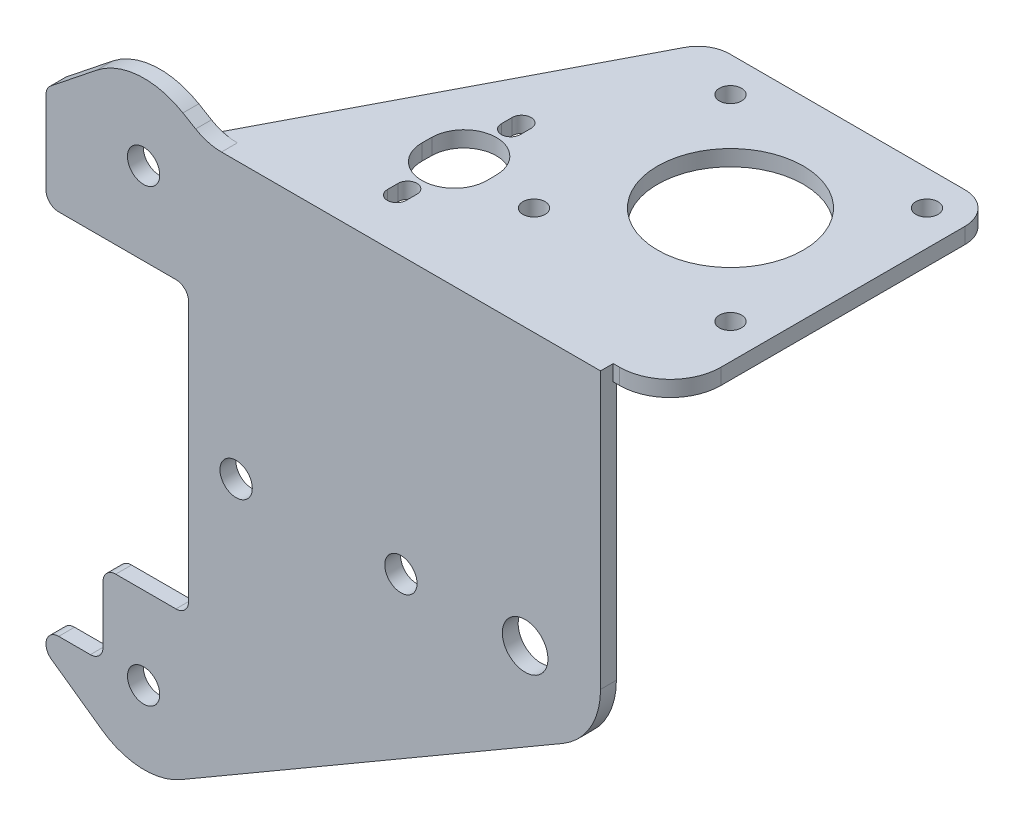
from build123d import *

# Parameters (mm, degrees)
SALIENTE_EXTRUIR1_DEPTH             = 2.5
CROQUIS2_W                          = 51
CROQUIS2_H                          = 2.5
SALIENTE_EXTRUIR2_DEPTH             = 36.177083333
SALIENTE_EXTRUIR3_DEPTH             = 2.5
CROQUIS4_W                          = 51.5
CROQUIS4_H                          = 2.5
SALIENTE_EXTRUIR4_DEPTH             = 9
CORTAR_EXTRUIR1_DEPTH               = 122.155458756
DI_METRO_DE_TALADRO_5_1_5_1_1_D     = 5.1
DI_METRO_DE_TALADRO_5_1_5_1_1_DEPTH = 53.5
DI_METRO_DE_TALADRO_5_1_5_1_2_D     = 5.1
DI_METRO_DE_TALADRO_7_2_7_2_1_D     = 7.2
DI_METRO_DE_TALADRO_23_0_23_1_D     = 23
DI_METRO_DE_TALADRO_23_0_23_1_DEPTH = 9.015002711
DI_METRO_DE_TALADRO_3_5_3_5_1_D     = 3.5
DI_METRO_DE_TALADRO_3_5_3_5_1_DEPTH = 9.015002711
REDONDEO1_R                         = 2
REDONDEO2_R                         = 5
REDONDEO3_R                         = 8
REDONDEO4_R                         = 11.5
REDONDEO5_R                         = 12
CORTAR_EXTRUIR2_DEPTH               = 10


with BuildPart() as part:
    # Croquis1 → Saliente-Extruir1 (new body)
    with BuildSketch(Plane(origin=(0, 43.526431985, 0), x_dir=(1, 0, 0), z_dir=(0, 1, 0))):
        Polygon((24.760416667, 29.4), (51.322916667, 29.4), (51.322916667, 80.4), align=None)
    extrude(amount=-SALIENTE_EXTRUIR1_DEPTH)

    # Croquis2 → Saliente-Extruir2 (add)
    with BuildSketch(Plane(origin=(51.322916667, 0, 0), x_dir=(0, 0, -1), z_dir=(1, 0, 0))):
        with Locations((54.9, 42.276431985)):
            Rectangle(CROQUIS2_W, CROQUIS2_H)
    extrude(amount=SALIENTE_EXTRUIR2_DEPTH)

    # Croquis3 → Saliente-Extruir3 (add)
    with BuildSketch(Plane.XY.offset(-29.4)):
        Polygon((0, -38.607215424), (0, 38.4885797), (14.488727812, 50.041434696), (25.5, 43.526431985), (87.5, 43.526431985), (87.5, -6.900242064), (14.886977722, -49.162809247), align=None)
    extrude(amount=SALIENTE_EXTRUIR3_DEPTH)

    # Croquis4 → Saliente-Extruir4 (add)
    with BuildSketch(Plane(origin=(87.5, 0, 0), x_dir=(0, 0, -1), z_dir=(1, 0, 0))):
        with Locations((54.65, 42.276431985)):
            Rectangle(CROQUIS4_W, CROQUIS4_H)
    extrude(amount=SALIENTE_EXTRUIR4_DEPTH)

    # Croquis5 → Cortar-Extruir1 (cut, through all)
    with BuildSketch(Plane.XY.offset(-26.9)):
        Polygon((0, 22.5), (0, -35.5), (9, -35.5), (9, -22.5), (22.5, -22.5), (22.5, 22.5), align=None)
    extrude(amount=-CORTAR_EXTRUIR1_DEPTH, mode=Mode.SUBTRACT)

    # Diámetro de taladro Ø5.1 (5.1)1
    with Locations(Plane.XY.offset(-26.9)):
        with Locations((56, 0), (30, 0)):
            Hole(DI_METRO_DE_TALADRO_5_1_5_1_1_D / 2, depth=DI_METRO_DE_TALADRO_5_1_5_1_1_DEPTH)

    # Diámetro de taladro Ø5.1 (5.1)2 (through all)
    with Locations(Plane(origin=(0, 0, -29.4), x_dir=(-1, 0, 0), z_dir=(0, 0, -1))):
        with Locations((-15.4, -35.5), (-15.4, 35.5)):
            Hole(DI_METRO_DE_TALADRO_5_1_5_1_2_D / 2)

    # Diámetro de taladro Ø7.2 (7.2)1 (through all)
    with Locations(Plane(origin=(0, 0, -29.4), x_dir=(-1, 0, 0), z_dir=(0, 0, -1))):
        with Locations((-75.6, 0)):
            Hole(DI_METRO_DE_TALADRO_7_2_7_2_1_D / 2)

    # Diámetro de taladro Ø23.0 (23)1
    with Locations(Plane(origin=(0, 41.026431985, 0), x_dir=(-1, 0, 0), z_dir=(0, -1, 0))):
        with Locations((-75.5, 59.4)):
            Hole(DI_METRO_DE_TALADRO_23_0_23_1_D / 2, depth=DI_METRO_DE_TALADRO_23_0_23_1_DEPTH)

    # Diámetro de taladro Ø3.5 (3.5)1
    with Locations(Plane(origin=(0, 41.026431985, 0), x_dir=(-1, 0, 0), z_dir=(0, -1, 0))):
        with Locations((-60, 74.9), (-91, 43.9), (-60, 43.9), (-91, 74.9)):
            Hole(DI_METRO_DE_TALADRO_3_5_3_5_1_D / 2, depth=DI_METRO_DE_TALADRO_3_5_3_5_1_DEPTH)

    # Redondeo1
    redondeo1_edges = [part.edges().sort_by_distance(p)[0] for p in [
        (0, -38.607215424, -28.15),
        (0, 38.4885797, -28.15),
        (0, 22.5, -28.15),
        (22.5, 22.5, -28.15),
        (22.5, -22.5, -28.15),
        (9, -22.5, -28.15),
        (9, -35.5, -28.15),
        (0, -35.5, -28.15),
    ]]
    fillet(redondeo1_edges, radius=REDONDEO1_R)

    # Redondeo2
    redondeo2_edges = [part.edges().sort_by_distance(p)[0] for p in [
        (96.5, 42.276431985, -80.4),
        (51.322916667, 42.276431985, -80.4),
    ]]
    fillet(redondeo2_edges, radius=REDONDEO2_R)

    # Redondeo3
    redondeo3_edges = [part.edges().sort_by_distance(p)[0] for p in [
        (25.5, 43.526431985, -28.15),
        (96.5, 42.276431985, -28.9),
    ]]
    fillet(redondeo3_edges, radius=REDONDEO3_R)

    # Redondeo4
    redondeo4_edges = [part.edges().sort_by_distance(p)[0] for p in [
        (14.886977722, -49.162809247, -28.15),
    ]]
    fillet(redondeo4_edges, radius=REDONDEO4_R)

    # Redondeo5
    redondeo5_edges = [part.edges().sort_by_distance(p)[0] for p in [
        (87.5, -6.900242064, -28.15),
        (14.488727812, 50.041434696, -28.15),
    ]]
    fillet(redondeo5_edges, radius=REDONDEO5_R)

    # Croquis19 → Cortar-Extruir2 (cut)
    with BuildSketch(Plane(origin=(0, 43.526431985, 0), x_dir=(1, 0, 0), z_dir=(0, 1, 0))):
        with BuildLine():
            Line((42.255993265, 44.007837327), (42.270997317, 45.507687231))
            ThreePointArc((42.270997317, 45.507687231), (47.390937401, 50.576665136), (52.510877484, 45.507687231))
            Line((52.510877484, 45.507687231), (52.525881536, 44.007837327))
            ThreePointArc((52.525881536, 44.007837327), (47.390937401, 38.821267806), (42.255993265, 44.007837327))
        make_face()
        with BuildLine():
            Line((45.903627778, 34.856468872), (45.903627778, 36.556468872))
            ThreePointArc((45.903627778, 36.556468872), (47.390937401, 38.043778494), (48.878247023, 36.556468872))
            Line((48.878247023, 36.556468872), (48.878247023, 34.856468872))
            ThreePointArc((48.878247023, 34.856468872), (47.390937401, 33.36915925), (45.903627778, 34.856468872))
        make_face()
        with BuildLine():
            Line((45.898554991, 52.856468872), (45.898554991, 54.556468872))
            ThreePointArc((45.898554991, 54.556468872), (47.390937401, 56.048851282), (48.883319811, 54.556468872))
            Line((48.883319811, 54.556468872), (48.883319811, 52.856468872))
            ThreePointArc((48.883319811, 52.856468872), (47.390937401, 51.364086462), (45.898554991, 52.856468872))
        make_face()
    extrude(amount=-CORTAR_EXTRUIR2_DEPTH, mode=Mode.SUBTRACT)


solid = part.part
